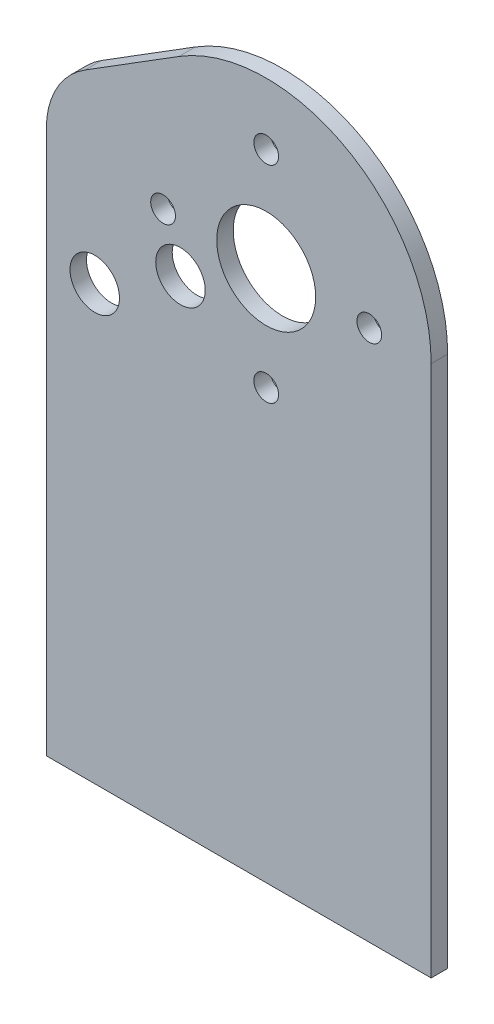
from build123d import *

# Parameters (mm, degrees)
BOSS_EXTRUDE1_DEPTH = 2
SKETCH2_R           = 6
SKETCH2_R_2         = 1.5
CUT_EXTRUDE1_DEPTH  = 2
SKETCH3_R           = 3
CUT_EXTRUDE2_DEPTH  = 2


with BuildPart() as part:
    # Sketch1 → Boss-Extrude1 (new body)
    with BuildSketch(Plane.XY):
        with BuildLine():
            Line((-10.598037339, 16.961179339), (-21.950536445, 9.8676744))
            ThreePointArc((-21.950536445, 9.8676744), (-25.397665118, 6.235270644), (-26.651517775, 1.38708473))
            Line((-26.651517775, 1.38708473), (-26.651517775, -64.494263033))
            Line((-26.651517775, -64.494263033), (20, -64.494263033))
            Line((20, -64.494263033), (20, 0))
            ThreePointArc((20, 0), (9.696371827, 17.492294686), (-10.598037339, 16.961179339))
        make_face()
    extrude(amount=BOSS_EXTRUDE1_DEPTH)

    # Sketch2 → Cut-Extrude1 (cut)
    with BuildSketch(Plane.XY.offset(2)):
        Circle(SKETCH2_R)
        with Locations((12.5, 0)):
            Circle(SKETCH2_R_2)
        with Locations((0, -12.5)):
            Circle(SKETCH2_R_2)
        with Locations((-12.5, 0)):
            Circle(SKETCH2_R_2)
        with Locations((0, 12.5)):
            Circle(SKETCH2_R_2)
    extrude(amount=-CUT_EXTRUDE1_DEPTH, mode=Mode.SUBTRACT)

    # Sketch3 → Cut-Extrude2 (cut)
    with BuildSketch(Plane(origin=(0, 0, 0), x_dir=(-1, 0, 0), z_dir=(0, 0, -1))):
        with Locations((10.392304845, -6)):
            Circle(SKETCH3_R)
        with Locations((20.784609691, -12)):
            Circle(SKETCH3_R)
    extrude(amount=-CUT_EXTRUDE2_DEPTH, mode=Mode.SUBTRACT)


solid = part.part
